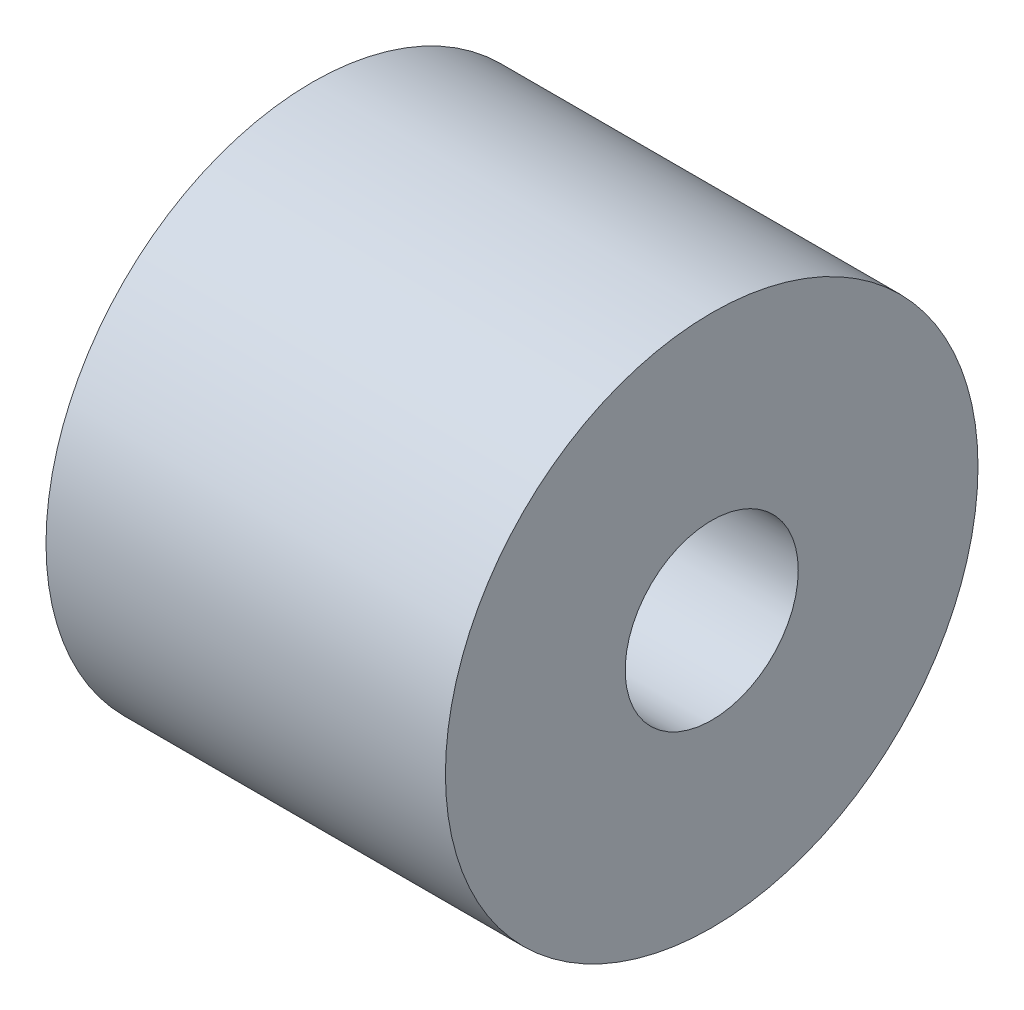
from build123d import *

# Parameters (mm, degrees)
SKETCH1_R           = 10
SKETCH1_R_2         = 3.25
BOSS_EXTRUDE1_DEPTH = 15


with BuildPart() as part:
    # Sketch1 → Boss-Extrude1 (new body)
    with BuildSketch(Plane(origin=(0, 0, 0), x_dir=(0, 0, -1), z_dir=(1, 0, 0))):
        Circle(SKETCH1_R)
        Circle(SKETCH1_R_2, mode=Mode.SUBTRACT)
    extrude(amount=BOSS_EXTRUDE1_DEPTH)


solid = part.part
